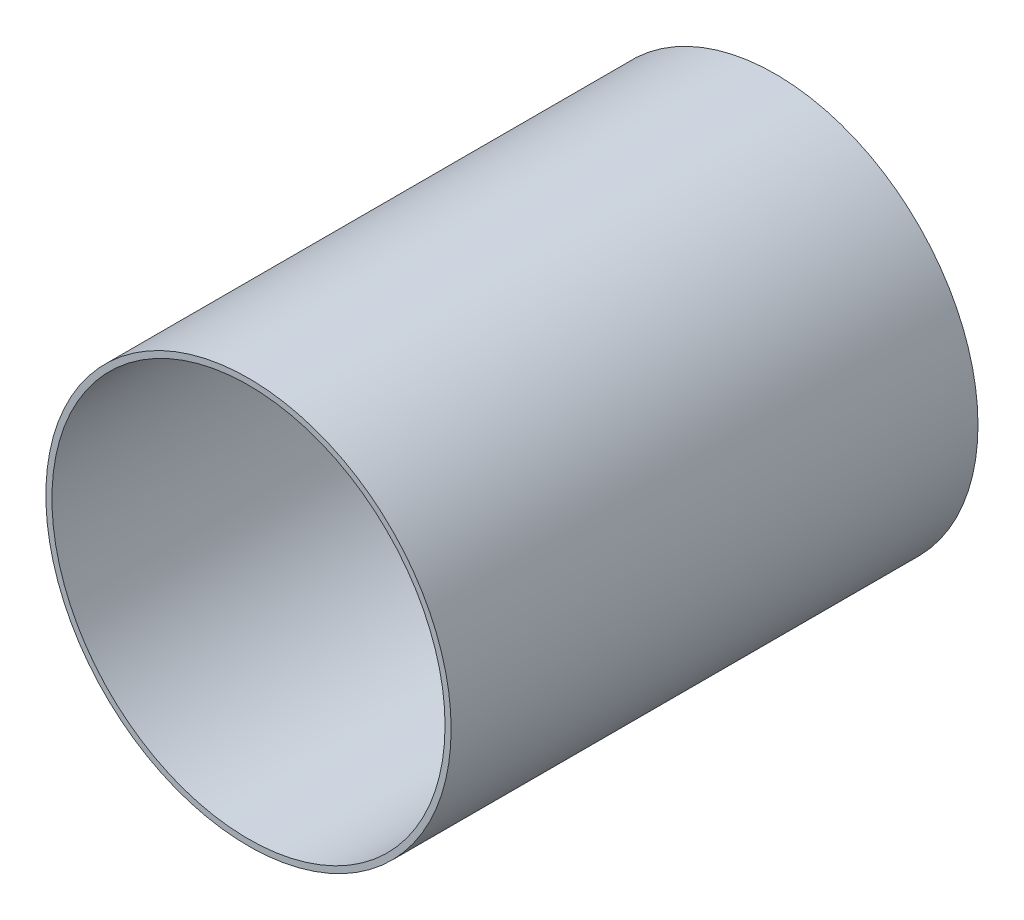
from build123d import *

# Parameters (mm, degrees)
SKETCH_1_R          = 50
EXTRUDE_1_DEPTH     = 130
SKETCH_2_R          = 48.5
CUT_EXTRUDE_1_DEPTH = 193


with BuildPart() as part:
    # 草图1 → 凸台-拉伸1 (new body)
    with BuildSketch(Plane.XY):
        Circle(SKETCH_1_R)
    extrude(amount=EXTRUDE_1_DEPTH)

    # 草图2 → 切除-拉伸1 (cut)
    with BuildSketch(Plane.XY):
        Circle(SKETCH_2_R)
    extrude(amount=CUT_EXTRUDE_1_DEPTH, mode=Mode.SUBTRACT)


solid = part.part
